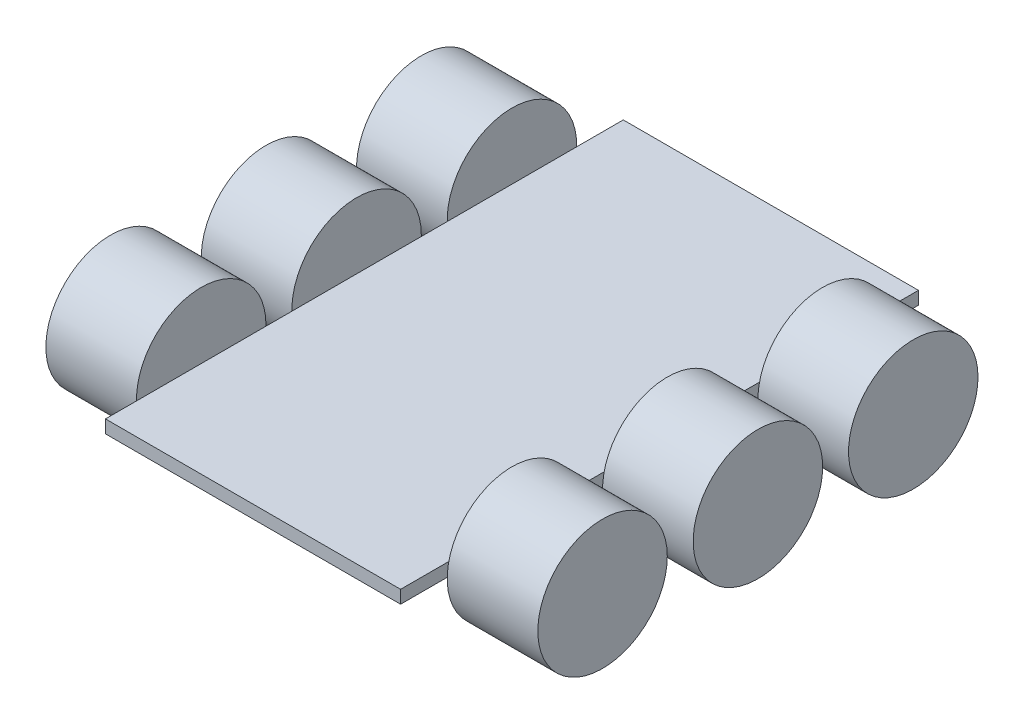
from build123d import *

# Parameters (mm, degrees)
SKETCH3_R             = 25
BOSS_EXTRUDE1_DEPTH   = 95
BOSS_EXTRUDE1_2_DEPTH = 95
BOSS_EXTRUDE1_3_DEPTH = 95
SKETCH3_3_R           = 25
CUT_EXTRUDE1_DEPTH    = 60
SKETCH4_W             = 114
SKETCH4_H             = 200
BOSS_EXTRUDE2_DEPTH   = 2.5


with BuildPart() as part:
    # Sketch3 → Boss-Extrude1 (new, symmetric)
    with BuildSketch(Plane(origin=(0, 0, 0), x_dir=(0, 0, -1), z_dir=(1, 0, 0))):
        with Locations((-60, 0)):
            Circle(SKETCH3_R)
    extrude(amount=BOSS_EXTRUDE1_DEPTH, both=True)


with BuildPart() as body_2:
    # Sketch3 → Boss-Extrude1 2 (new, symmetric)
    with BuildSketch(Plane(origin=(0, 0, 0), x_dir=(0, 0, -1), z_dir=(1, 0, 0))):
        with Locations((60, 0)):
            Circle(SKETCH3_R)
    extrude(amount=BOSS_EXTRUDE1_2_DEPTH, both=True)


with BuildPart() as body_3:
    # Sketch3 → Boss-Extrude1 3 (new, symmetric)
    with BuildSketch(Plane(origin=(0, 0, 0), x_dir=(0, 0, -1), z_dir=(1, 0, 0))):
        Circle(SKETCH3_R)
    extrude(amount=BOSS_EXTRUDE1_3_DEPTH, both=True)


with BuildPart() as cut_extrude1_tool:
    # Sketch3<3> → Cut-Extrude1 (new, symmetric)
    with BuildSketch(Plane(origin=(0, 0, 0), x_dir=(0, 0, -1), z_dir=(1, 0, 0))):
        with Locations((-60, 0)):
            Circle(SKETCH3_3_R)
        with Locations((60, 0)):
            Circle(SKETCH3_3_R)
        Circle(SKETCH3_3_R)
    extrude(amount=CUT_EXTRUDE1_DEPTH, both=True)


with BuildPart() as part_1:
    add(part.part)

    # Cut-Extrude1: cut by cut_extrude1_tool
    add(cut_extrude1_tool.part, mode=Mode.SUBTRACT)


with BuildPart() as body_2_1:
    add(body_2.part)

    # Cut-Extrude1: cut by cut_extrude1_tool
    add(cut_extrude1_tool.part, mode=Mode.SUBTRACT)


with BuildPart() as body_3_1:
    add(body_3.part)

    # Cut-Extrude1: cut by cut_extrude1_tool
    add(cut_extrude1_tool.part, mode=Mode.SUBTRACT)


with BuildPart() as cut_extrude1_piece_1:
    # of the separate pieces the step leaves, piece 1, a body of its own (cut_extrude1_pieces)
    add(part_1.part.solids().sort_by_distance((-95, 0, 35))[0])


with BuildPart() as cut_extrude1_piece_2:
    # of the separate pieces the step leaves, piece 2, a body of its own (cut_extrude1_pieces)
    add(part_1.part.solids().sort_by_distance((60, 0, 35))[0])


with BuildPart() as cut_extrude1_piece_1_of_body_2:
    # of the separate pieces the step leaves, piece 1, a body of its own (cut_extrude1_pieces_of_body_2)
    add(body_2_1.part.solids().sort_by_distance((-95, 0, -85))[0])


with BuildPart() as cut_extrude1_piece_2_of_body_2:
    # of the separate pieces the step leaves, piece 2, a body of its own (cut_extrude1_pieces_of_body_2)
    add(body_2_1.part.solids().sort_by_distance((60, 0, -85))[0])


with BuildPart() as cut_extrude1_piece_1_of_body_3:
    # of the separate pieces the step leaves, piece 1, a body of its own (cut_extrude1_pieces_of_body_3)
    add(body_3_1.part.solids().sort_by_distance((-95, 0, -25))[0])


with BuildPart() as cut_extrude1_piece_2_of_body_3:
    # of the separate pieces the step leaves, piece 2, a body of its own (cut_extrude1_pieces_of_body_3)
    add(body_3_1.part.solids().sort_by_distance((60, 0, -25))[0])


with BuildPart() as body_7:
    # Sketch4 → Boss-Extrude2 (new, symmetric)
    with BuildSketch(Plane(origin=(0, 0, 0), x_dir=(1, 0, 0), z_dir=(0, 1, 0))):
        Rectangle(SKETCH4_W, SKETCH4_H)
    extrude(amount=BOSS_EXTRUDE2_DEPTH, both=True)


solid = Compound([cut_extrude1_piece_1.part, cut_extrude1_piece_2.part, cut_extrude1_piece_1_of_body_2.part, cut_extrude1_piece_2_of_body_2.part, cut_extrude1_piece_1_of_body_3.part, cut_extrude1_piece_2_of_body_3.part, body_7.part])
